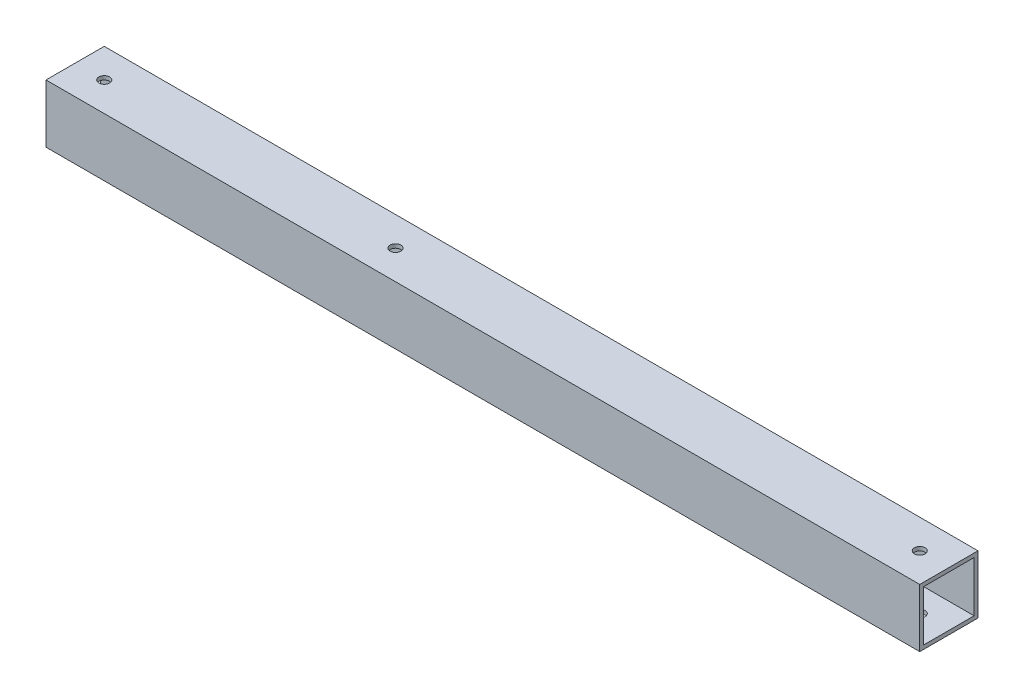
from build123d import *

# Parameters (mm, degrees)
SKETCH1_W               = 30
SKETCH1_H               = 30
SKETCH1_W_2             = 26
SKETCH1_H_2             = 26
BOSS_EXTRUDE1_DEPTH     = 225
SKETCH2_R               = 2.75
CUT_EXTRUDE1_DEPTH      = 226.9977876
CUT_EXTRUDE2_DEPTH      = 226.9977876
CUT_EXTRUDE2_DEPTH_BACK = 226.9977876
SKETCH3_R               = 2.75


with BuildPart() as part:
    # Sketch1 → Boss-Extrude1 (new, symmetric)
    with BuildSketch(Plane(origin=(0, 0, 0), x_dir=(0, 0, -1), z_dir=(1, 0, 0))):
        Rectangle(SKETCH1_W, SKETCH1_H)
        Rectangle(SKETCH1_W_2, SKETCH1_H_2, mode=Mode.SUBTRACT)
    extrude(amount=BOSS_EXTRUDE1_DEPTH, both=True)

    # Sketch2 → Cut-Extrude1 (cut, symmetric)
    with BuildSketch(Plane(origin=(0, 0, 0), x_dir=(1, 0, 0), z_dir=(0, 1, 0))):
        with Locations(Location((210, 0, 0), (0, 0, 270))):
            Circle(SKETCH2_R)
    cut_extrude1 = extrude(amount=CUT_EXTRUDE1_DEPTH, both=True, mode=Mode.SUBTRACT)

    # Mirror1: Cut-Extrude1 across plane
    add(cut_extrude1.mirror(Plane(origin=(0, 0, 0), x_dir=(0, 0, 1), z_dir=(1, 0, 0))), mode=Mode.SUBTRACT)

    # Sketch3 → Cut-Extrude2 (cut, two sides: drawn at the far end of the back side and taken through both)
    with BuildSketch(Plane(origin=(0, 0, 0), x_dir=(1, 0, 0), z_dir=(0, 1, 0)).offset(-CUT_EXTRUDE2_DEPTH_BACK)):
        with Locations(Location((-60, 0, 0), (0, 0, 270))):
            Circle(SKETCH3_R)
    extrude(amount=CUT_EXTRUDE2_DEPTH + CUT_EXTRUDE2_DEPTH_BACK, mode=Mode.SUBTRACT)


solid = part.part
